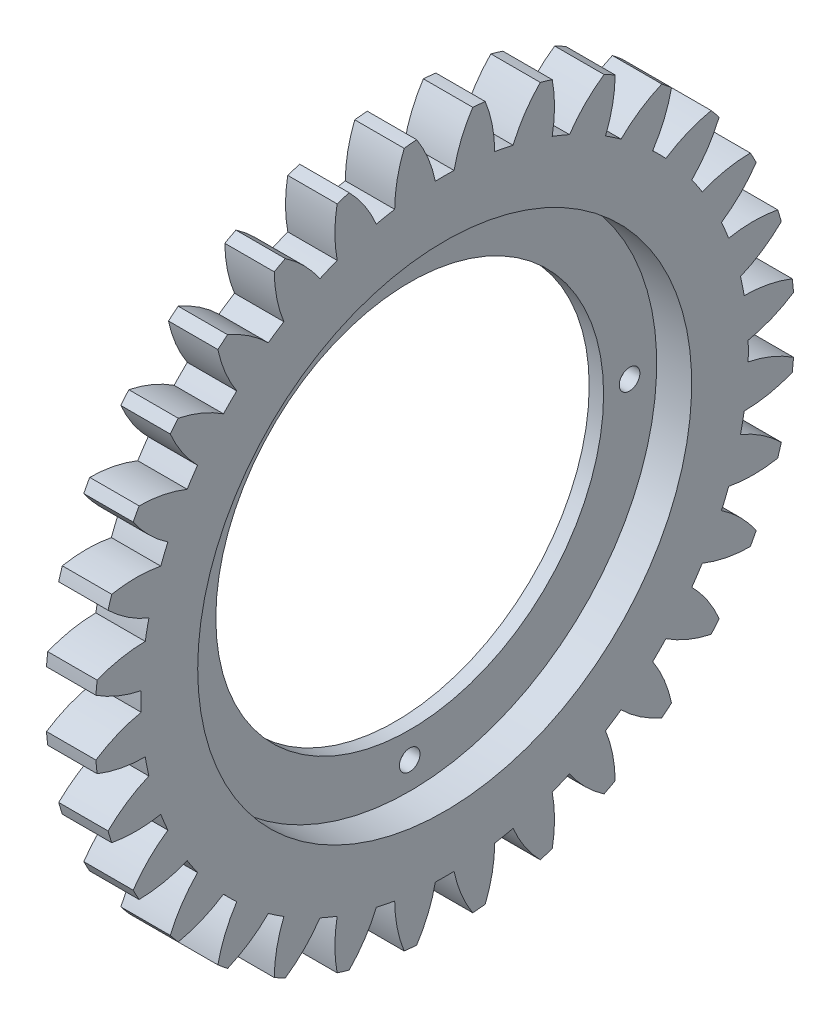
from build123d import *

# Parameters (mm, degrees)
TOOTHCUT_DEPTH     = 121.805629008
TEETHCUTS_COUNT    = 32
TEETHCUTS_ANGLE    = 348.75
BORSKE_R           = 47.1
BORE_DEPTH         = 50.0000508
CUT_EXTRUDE1_REACH = 122.421
SKETCH1_R          = 2.5


with BuildPart() as part:
    # BasProSke → Base-Revolve (revolve)
    with BuildSketch(Plane(origin=(0, 0, 0), x_dir=(1, 0, 0), z_dir=(0, 1, 0)), mode=Mode.PRIVATE) as base_revolve_sk:
        Polygon((0, 0), (0, 85), (12, 85), (12, 60), (3.5, 60), (3.5, 0), align=None)
    revolve(base_revolve_sk.sketch.rotate(Axis((-10, 0, 0), (1, 0, 0)), 180), axis=Axis((-10, 0, 0), (1, 0, 0)))

    # TooCutSke → ToothCut (cut, through all)
    with BuildSketch(Plane(origin=(0, 0, 0), x_dir=(0, 0, -1), z_dir=(1, 0, 0))):
        with BuildLine():
            ThreePointArc((2.273882543, 73.713936669), (0, 73.749), (-2.273882543, 73.713936669))
            ThreePointArc((-2.273882543, 73.713936669), (-4.031320982, 79.446636556), (-6.827354076, 84.750845904))
            ThreePointArc((-6.827354076, 84.750845904), (0, 85.0254), (6.827354076, 84.750845904))
            ThreePointArc((6.827354076, 84.750845904), (4.031320982, 79.446636556), (2.273882543, 73.713936669))
        make_face()
    toothcut = extrude(amount=TOOTHCUT_DEPTH, mode=Mode.SUBTRACT)

    # TeethCuts: ToothCut ×32 about axis
    teethcuts_axis = Axis((-10, 0, 0), (1, 0, 0))
    for i in range(1, TEETHCUTS_COUNT):
        add(toothcut.rotate(teethcuts_axis, i * TEETHCUTS_ANGLE / (TEETHCUTS_COUNT - 1)), mode=Mode.SUBTRACT)

    # BorSke → Bore (cut, symmetric)
    with BuildSketch(Plane(origin=(0, 0, 0), x_dir=(0, 0, -1), z_dir=(1, 0, 0))):
        with Locations(Location((0, 0, 0), (0, 0, 180))):
            Circle(BORSKE_R)
    extrude(amount=BORE_DEPTH, both=True, mode=Mode.SUBTRACT)

    # Sketch1 → Cut-Extrude1 (cut, up to next)
    with BuildSketch(Plane(origin=(12, 0, 0), x_dir=(0, 0, -1), z_dir=(1, 0, 0)), mode=Mode.PRIVATE) as cut_extrude1_sk1:
        with Locations((0, 53.4)):
            Circle(SKETCH1_R)
    cut_extrude1_tool1 = extrude(cut_extrude1_sk1.sketch, amount=-CUT_EXTRUDE1_REACH, mode=Mode.PRIVATE) & part.part
    # Sketch1 → Cut-Extrude1 (cut, up to next)
    with BuildSketch(Plane(origin=(12, 0, 0), x_dir=(0, 0, -1), z_dir=(1, 0, 0)), mode=Mode.PRIVATE) as cut_extrude1_sk2:
        with Locations((53.4, 0)):
            Circle(SKETCH1_R)
    cut_extrude1_tool2 = extrude(cut_extrude1_sk2.sketch, amount=-CUT_EXTRUDE1_REACH, mode=Mode.PRIVATE) & part.part
    # Sketch1 → Cut-Extrude1 (cut, up to next)
    with BuildSketch(Plane(origin=(12, 0, 0), x_dir=(0, 0, -1), z_dir=(1, 0, 0)), mode=Mode.PRIVATE) as cut_extrude1_sk3:
        with Locations((0, -53.4)):
            Circle(SKETCH1_R)
    cut_extrude1_tool3 = extrude(cut_extrude1_sk3.sketch, amount=-CUT_EXTRUDE1_REACH, mode=Mode.PRIVATE) & part.part
    # Sketch1 → Cut-Extrude1 (cut, up to next)
    with BuildSketch(Plane(origin=(12, 0, 0), x_dir=(0, 0, -1), z_dir=(1, 0, 0)), mode=Mode.PRIVATE) as cut_extrude1_sk4:
        with Locations((-53.4, 0)):
            Circle(SKETCH1_R)
    cut_extrude1_tool4 = extrude(cut_extrude1_sk4.sketch, amount=-CUT_EXTRUDE1_REACH, mode=Mode.PRIVATE) & part.part
    add(cut_extrude1_tool1.solids().sort_by_distance((12, 53.4, 0))[0], mode=Mode.SUBTRACT)
    add(cut_extrude1_tool2.solids().sort_by_distance((12, 0, -53.4))[0], mode=Mode.SUBTRACT)
    add(cut_extrude1_tool3.solids().sort_by_distance((12, -53.4, 0))[0], mode=Mode.SUBTRACT)
    add(cut_extrude1_tool4.solids().sort_by_distance((12, 0, 53.4))[0], mode=Mode.SUBTRACT)


solid = part.part
